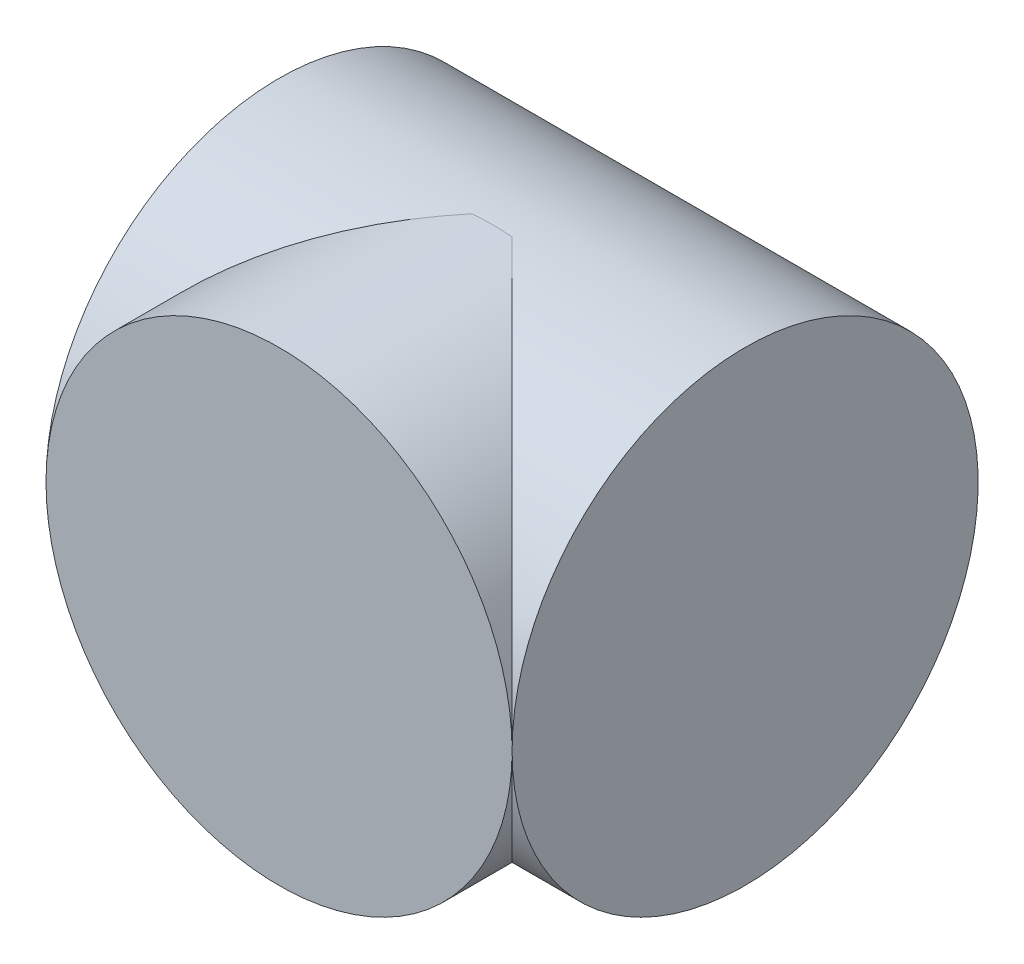
from build123d import *
from build123d.topology import SkipClean

# Parameters (mm, degrees)
SKETCH_1_R      = 35
EXTRUDE_1_DEPTH = 70
SKETCH_2_R      = 35
EXTRUDE_2_DEPTH = 32


with BuildPart() as part:
    # 草图1 → 凸台-拉伸1 (new body)
    with BuildSketch(Plane(origin=(0, 0, 0), x_dir=(0, 0, -1), z_dir=(1, 0, 0))):
        Circle(SKETCH_1_R)
    extrude(amount=EXTRUDE_1_DEPTH)

    # 草图2 → 凸台-拉伸2 (add)
    with SkipClean():  # the faces are left unmerged after this step: merging them gives an invalid solid
        with BuildSketch(Plane.XY.offset(35)):
            with Locations((35, 0)):
                Circle(SKETCH_2_R)
        extrude(amount=-EXTRUDE_2_DEPTH)


solid = part.part
